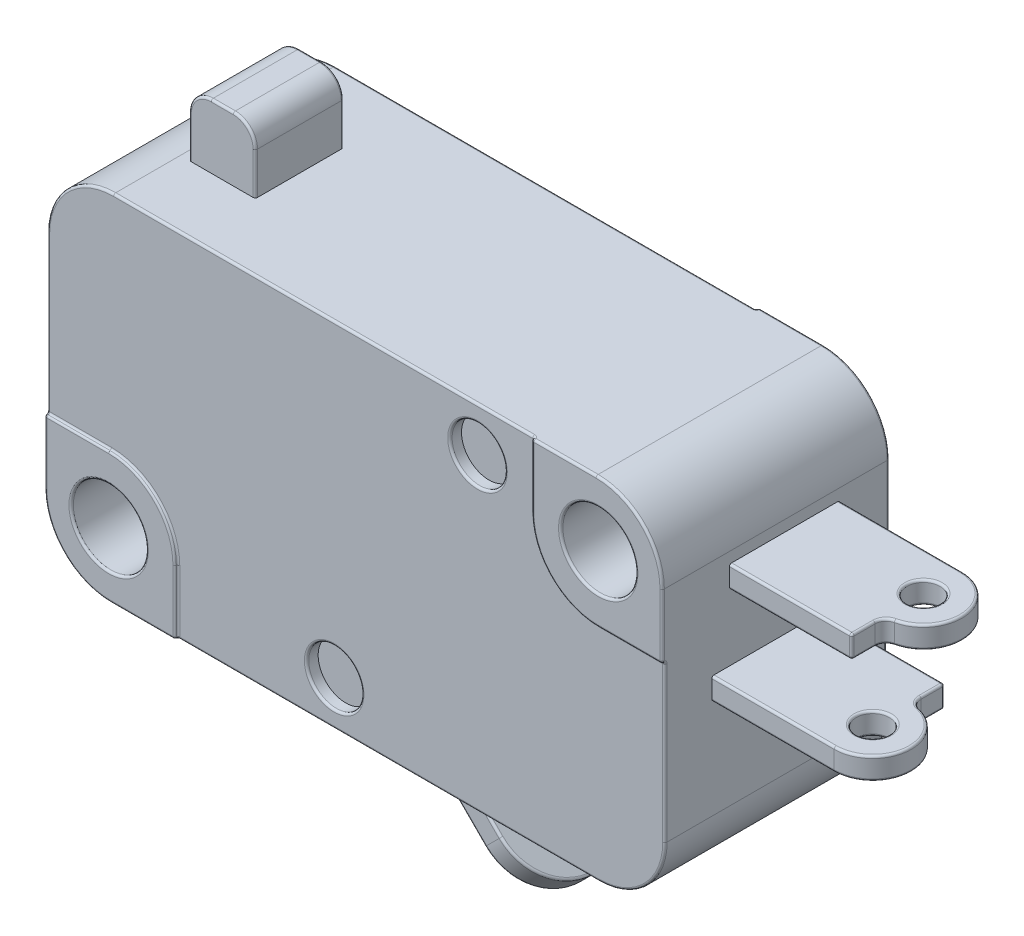
from build123d import *

# Parameters (mm, degrees)
PROFILE_SKETCH_1_W    = 28
PROFILE_SKETCH_1_H    = 16
BODY_1_DEPTH          = 5.025
BODY_2_DEPTH          = 5.15
BODY_FILLET_R         = 3
BODY_3_DEPTH          = 17.926975512
BODY_3_DEPTH_BACK     = 17.926975512
PROFILE_SKETCH_3_R    = 1.7
BODY_START            = 5.15
PROFILE_SKETCH_4_R    = 1.25
BODY_4_DEPTH          = 0.65
BODY_5_DEPTH          = 2
PROFILE_SKETCH_6_W    = 5
PROFILE_SKETCH_6_H    = 1
BODY_6_DEPTH          = 7.3
BODY_7_DEPTH          = 2.5
BODY_START_2          = -1
PROFILE_SKETCH_8_R    = 0.75
BODY_8_DEPTH          = 1
PROFILE_SKETCH_9_R    = 0.75
BODY_9_DEPTH          = 1
PROFILE_SKETCH_10_R   = 0.75
BODY_10_DEPTH         = 1
PRODUCTION_FILLET_1_R = 0.1
PRODUCTION_FILLET_2_R = 0.1
PRODUCTION_FILLET_3_R = 0.1
PRODUTION_FILLET_4_R  = 0.1


with BuildPart() as part:
    # Profile Sketch 1 → Body 1 (new, symmetric)
    with BuildSketch(Plane.XY):
        Rectangle(PROFILE_SKETCH_1_W, PROFILE_SKETCH_1_H)
    extrude(amount=BODY_1_DEPTH, both=True)

    # Profile Sketch 2 → Body 2 (add, symmetric)
    with BuildSketch(Plane.XY):
        with BuildLine():
            Line((-14, -2.1), (-11.1, -2.1))
            ThreePointArc((-11.1, -2.1), (-8.978679656, -2.978679656), (-8.1, -5.1))
            Line((-8.1, -5.1), (-8.1, -8))
            Line((-8.1, -8), (-14, -8))
            Line((-14, -8), (-14, -2.1))
        make_face()
        with BuildLine():
            Line((8.1, 8), (14, 8))
            Line((14, 8), (14, 2.1))
            Line((14, 2.1), (11.1, 2.1))
            ThreePointArc((11.1, 2.1), (8.978679656, 2.978679656), (8.1, 5.1))
            Line((8.1, 5.1), (8.1, 8))
        make_face()
    extrude(amount=BODY_2_DEPTH, both=True)

    # Body Fillet
    body_fillet_edges = [part.edges().sort_by_distance(p)[0] for p in [
        (14, -8, 0),
        (-14, -8, 0),
        (-14, 8, 0),
        (14, 8, 0),
    ]]
    fillet(body_fillet_edges, radius=BODY_FILLET_R)

    # Profile Sketch 3 → Body 3 (cut, two sides: drawn at the far end of the back side and taken through both)
    with BuildSketch(Plane.XY.offset(-BODY_3_DEPTH_BACK)):
        with Locations((11.1, 5.1)):
            Circle(PROFILE_SKETCH_3_R)
        with Locations((-11.1, -5.1)):
            Circle(PROFILE_SKETCH_3_R)
    extrude(amount=BODY_3_DEPTH + BODY_3_DEPTH_BACK, mode=Mode.SUBTRACT)

    # Profile Sketch 4 → Body 4 (cut)
    with BuildSketch(Plane.XY.offset(BODY_START)):
        with Locations((5.5, 6)):
            Circle(PROFILE_SKETCH_4_R)
        with Locations((-1, -6)):
            Circle(PROFILE_SKETCH_4_R)
    body_4 = extrude(amount=-BODY_4_DEPTH, mode=Mode.SUBTRACT)

    # Mirror Body 4: Body 4 across plane
    add(body_4.mirror(Plane.XY), mode=Mode.SUBTRACT)

    # Profile Sketch 5 → Body 5 (add, symmetric)
    with BuildSketch(Plane.XY):
        with BuildLine():
            Line((-10.6, 8), (-10.6, 9.9))
            ThreePointArc((-10.6, 9.9), (-10.307106781, 10.607106781), (-9.6, 10.9))
            Line((-9.6, 10.9), (-8.6, 10.9))
            ThreePointArc((-8.6, 10.9), (-7.892893219, 10.607106781), (-7.6, 9.9))
            Line((-7.6, 9.9), (-7.6, 8))
            Line((-7.6, 8), (-10.6, 8))
        make_face()
    extrude(amount=BODY_5_DEPTH, both=True)

    # Profile Sketch 6 → Body 6 (add)
    with BuildSketch(Plane(origin=(14, 0, 0), x_dir=(0, 0, -1), z_dir=(1, 0, 0))):
        with Locations((0.4, 4)):
            Rectangle(PROFILE_SKETCH_6_W, PROFILE_SKETCH_6_H)
        with Locations((-0.4, 0)):
            Rectangle(PROFILE_SKETCH_6_W, PROFILE_SKETCH_6_H)
    extrude(amount=BODY_6_DEPTH)

    # Profile Sketch 7 → Body 7 (add, symmetric)
    with BuildSketch(Plane.XY):
        with BuildLine():
            Line((2.5, -8), (2.5, -9.085786438))
            ThreePointArc((2.5, -9.085786438), (2.576120467, -9.46846987), (2.792893219, -9.792893219))
            Line((2.792893219, -9.792893219), (5.792893219, -12.792893219))
            Line((5.792893219, -12.792893219), (5.085786438, -13.5))
            Line((5.085786438, -13.5), (2.085786438, -10.5))
            ThreePointArc((2.085786438, -10.5), (1.652240935, -9.851153302), (1.5, -9.085786438))
            Line((1.5, -9.085786438), (1.5, -8))
            Line((1.5, -8), (2.5, -8))
        make_face()
    extrude(amount=BODY_7_DEPTH, both=True)

    # Profile Sketch 8 → Body 8 (cut)
    with BuildSketch(Plane(origin=(0, 4.5, 0), x_dir=(1, 0, 0), z_dir=(0, 1, 0)).offset(BODY_START_2)):
        with Locations(Location((19.55, 1.15, 0), (0, 0, 270))):
            Circle(PROFILE_SKETCH_8_R)
        with BuildLine():
            Line((19.55, -1.043741097), (19.55, -2.9))
            Line((19.55, -2.9), (21.55, -2.9))
            Line((21.55, -2.9), (21.55, 2.9))
            Line((21.55, 2.9), (19.55, 2.9))
            ThreePointArc((19.55, 2.9), (21.289026363, 1.345671431), (19.938888889, -0.556243075))
            ThreePointArc((19.938888889, -0.556243075), (19.65913202, -0.731936315), (19.55, -1.043741097))
        make_face()
    extrude(amount=BODY_8_DEPTH, mode=Mode.SUBTRACT)

    # Profile Sketch 9 → Body 9 (cut)
    with BuildSketch(Plane.XZ.offset(0.5).offset(BODY_START_2)):
        with Locations(Location((19.55, 1.15, 0), (0, 0, 270))):
            Circle(PROFILE_SKETCH_9_R)
        with BuildLine():
            Line((19.55, -1.043741097), (19.55, -2.1))
            Line((19.55, -2.1), (21.55, -2.1))
            Line((21.55, -2.1), (21.55, 2.9))
            Line((21.55, 2.9), (19.55, 2.9))
            ThreePointArc((19.55, 2.9), (21.289026363, 1.345671431), (19.938888889, -0.556243075))
            ThreePointArc((19.938888889, -0.556243075), (19.65913202, -0.731936315), (19.55, -1.043741097))
        make_face()
    extrude(amount=BODY_9_DEPTH, mode=Mode.SUBTRACT)

    # Profile Sketch 10 → Body 10 (cut)
    with BuildSketch(Plane(origin=(-4.207106781, -4.207106781, 0), x_dir=(0, 0, 1), z_dir=(-0.7071067811865391, -0.7071067811865559, 0)).offset(BODY_START_2)):
        with Locations(Location((0, -10.642135624, 0), (0, 0, 270))):
            Circle(PROFILE_SKETCH_10_R)
        with BuildLine():
            Line((-2.5, -10.642135624), (-2.5, -13.435028843))
            Line((-2.5, -13.435028843), (2.5, -13.435028843))
            Line((2.5, -13.435028843), (2.5, -10.642135624))
            ThreePointArc((2.5, -10.642135624), (0, -13.142135624), (-2.5, -10.642135624))
        make_face()
    extrude(amount=BODY_10_DEPTH, mode=Mode.SUBTRACT)

    # Production Fillet 1
    production_fillet_1_edges = [part.edges().sort_by_distance(p)[0] for p in [
        (1.5, -8.542893219, -2.5),
        (1.652240935, -9.851153302, -2.5),
        (2.701902961, -11.116116524, -2.5),
        (2.576120467, -9.46846987, -2.5),
        (2.5, -8.542893219, -2.5),
        (1.5, -8.542893219, 2.5),
        (1.652240935, -9.851153302, 2.5),
        (2.701902961, -11.116116524, 2.5),
        (2.576120467, -9.46846987, 2.5),
        (2.5, -8.542893219, 2.5),
        (16.775, 3.5, -2.9),
        (16.775, 4.5, -2.9),
        (20.787436867, 3.5, -2.387436867),
        (20.787436867, 4.5, -2.387436867),
        (19.55, 4.5, -1.9),
        (19.55, 3.5, -1.9),
        (16.775, 3.5, 2.1),
        (16.775, 4.5, 2.1),
        (19.55, 4, 2.1),
        (19.65913202, 3.5, 0.731936315),
        (19.55, 3.5, 1.571870548),
        (19.55, 4.5, 1.571870548),
        (19.65913202, 4.5, 0.731936315),
        (16.775, -0.5, 2.9),
        (16.775, 0.5, 2.9),
        (20.787436867, 0.5, 2.387436867),
        (20.787436867, -0.5, 2.387436867),
        (16.775, 0.5, -2.1),
        (16.775, -0.5, -2.1),
        (19.65913202, 0.5, -0.731936315),
        (19.55, 0.5, -1.571870548),
        (19.65913202, -0.5, -0.731936315),
        (19.55, -0.5, -1.571870548),
        (19.55, 0, -2.1),
        (19.55, -0.5, 1.9),
        (19.55, 0.5, 1.9),
        (3.409009742, -10.409009742, 2.5),
        (5.275126271, -12.275126271, 1.767766945),
        (4.568019488, -12.98223305, -1.767766949),
        (2.787689399, -11.201902961, 0),
        (3.49479618, -10.49479618, 0),
        (3.409009742, -10.409009742, -2.5),
    ]]
    fillet(production_fillet_1_edges, radius=PRODUCTION_FILLET_1_R)

    # Production Fillet 2
    production_fillet_2_edges = [part.edges().sort_by_distance(p)[0] for p in [
        (-7.6, 8.95, -2),
        (-7.892893219, 10.607106781, -2),
        (-9.1, 10.9, -2),
        (-10.307106781, 10.607106781, -2),
        (-10.6, 8.95, -2),
        (-7.6, 8.95, 2),
        (-7.892893219, 10.607106781, 2),
        (-9.1, 10.9, 2),
        (-10.307106781, 10.607106781, 2),
        (-10.6, 8.95, 2),
    ]]
    fillet(production_fillet_2_edges, radius=PRODUCTION_FILLET_2_R)

    # Production Fillet 3
    production_fillet_3_edges = [part.edges().sort_by_distance(p)[0] for p in [
        (4.25, 6, 5.025),
        (-2.25, -6, 5.025),
        (4.25, 6, -5.025),
        (-2.25, -6, -5.025),
        (1.45, -8, -5.025),
        (-12.55, -2.1, -5.025),
        (-8.978679656, -2.978679656, -5.025),
        (-8.1, -6.55, -5.025),
        (1.45, -8, 5.025),
        (-8.1, -6.55, 5.025),
        (-8.1, -8, -5.0875),
        (-8.978679656, -2.978679656, 5.025),
        (-12.55, -2.1, 5.025),
        (-14, -2.1, -5.0875),
        (-8.1, -8, 5.0875),
        (-14, -2.1, 5.0875),
        (-1.45, 8, -5.025),
        (-1.45, 8, 5.025),
        (8.978679656, 2.978679656, -5.025),
        (8.978679656, 2.978679656, 5.025),
        (12.55, 2.1, 5.025),
        (12.55, 2.1, -5.025),
        (14, 2.1, -5.0875),
        (8.1, 6.55, 5.025),
        (8.1, 6.55, -5.025),
        (8.1, 8, -5.0875),
        (14, 2.1, 5.0875),
        (8.1, 8, 5.0875),
        (-14, 1.45, 5.025),
        (-14, 1.45, -5.025),
        (14, -1.45, 5.025),
        (14, -1.45, -5.025),
        (-13.121320344, 7.121320344, -5.025),
        (13.121320344, -7.121320344, -5.025),
        (-13.121320344, 7.121320344, 5.025),
        (13.121320344, -7.121320344, 5.025),
    ]]
    fillet(production_fillet_3_edges, radius=PRODUCTION_FILLET_3_R)

    # Prodution Fillet 4
    prodution_fillet_4_edges = [part.edges().sort_by_distance(p)[0] for p in [
        (13.121320344, 7.121320344, 5.15),
        (14, 3.6, 5.15),
        (13.970710678, 2.129289322, 5.15),
        (12.5, 2.1, 5.15),
        (8.978679656, 2.978679656, 5.15),
        (8.1, 6.5, 5.15),
        (8.129289322, 7.970710678, 5.15),
        (9.6, 8, 5.15),
        (9.4, 5.1, 5.15),
        (-13.121320344, -7.121320344, 5.15),
        (-14, -3.6, 5.15),
        (-13.970710678, -2.129289322, 5.15),
        (-12.5, -2.1, 5.15),
        (-8.978679656, -2.978679656, 5.15),
        (-8.1, -6.5, 5.15),
        (-8.129289322, -7.970710678, 5.15),
        (-9.6, -8, 5.15),
        (-12.8, -5.1, 5.15),
        (13.121320344, 7.121320344, -5.15),
        (9.6, 8, -5.15),
        (8.129289322, 7.970710678, -5.15),
        (8.1, 6.5, -5.15),
        (8.978679656, 2.978679656, -5.15),
        (12.5, 2.1, -5.15),
        (13.970710678, 2.129289322, -5.15),
        (14, 3.6, -5.15),
        (9.4, 5.1, -5.15),
        (-13.121320344, -7.121320344, -5.15),
        (-9.6, -8, -5.15),
        (-8.129289322, -7.970710678, -5.15),
        (-8.1, -6.5, -5.15),
        (-8.978679656, -2.978679656, -5.15),
        (-12.5, -2.1, -5.15),
        (-13.970710678, -2.129289322, -5.15),
        (-14, -3.6, -5.15),
        (-12.8, -5.1, -5.15),
    ]]
    fillet(prodution_fillet_4_edges, radius=PRODUTION_FILLET_4_R)


solid = part.part
